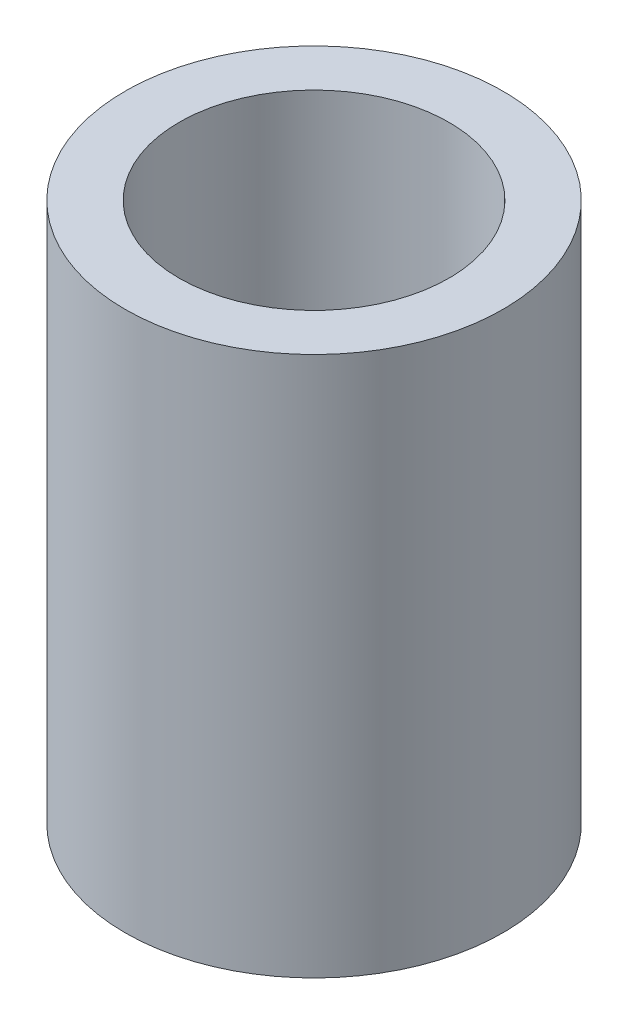
from build123d import *

# Parameters (mm, degrees)
SKETCH1_R           = 3.5
SKETCH1_R_2         = 2.5
BOSS_EXTRUDE1_DEPTH = 10


with BuildPart() as part:
    # Sketch1 → Boss-Extrude1 (new body)
    with BuildSketch(Plane(origin=(0, 0, 0), x_dir=(1, 0, 0), z_dir=(0, 1, 0))):
        with Locations(Location((0, 0, 0), (0, 0, 270))):
            Circle(SKETCH1_R)
        with Locations(Location((0, 0, 0), (0, 0, 270))):
            Circle(SKETCH1_R_2, mode=Mode.SUBTRACT)
    extrude(amount=BOSS_EXTRUDE1_DEPTH)


solid = part.part
